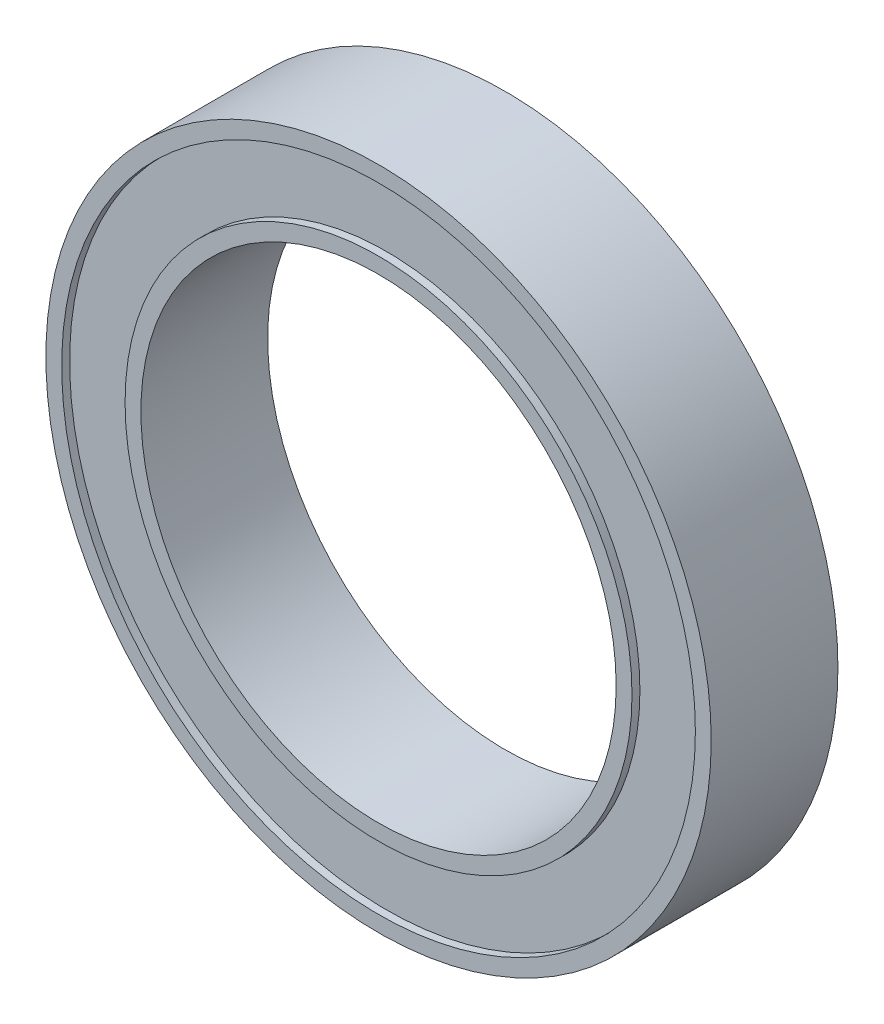
from build123d import *

# Parameters (mm, degrees)
SKETCH2_R             = 10.5
SKETCH2_R_2           = 10
BOSS_EXTRUDE2_DEPTH   = 4
SKETCH2_R_3           = 8
SKETCH2_R_4           = 7.5
BOSS_EXTRUDE2_2_DEPTH = 4
BOSS_EXTRUDE3_START   = 0.25
SKETCH1_R             = 10.5
SKETCH1_R_2           = 7.5
BOSS_EXTRUDE3_DEPTH   = 3.5


with BuildPart() as part:
    # Sketch2 → Boss-Extrude2 (new body)
    with BuildSketch(Plane.XY):
        Circle(SKETCH2_R)
        Circle(SKETCH2_R_2, mode=Mode.SUBTRACT)
    extrude(amount=BOSS_EXTRUDE2_DEPTH)



with BuildPart() as body_2:
    # Sketch2 → Boss-Extrude2 2 (new body)
    with BuildSketch(Plane.XY):
        Circle(SKETCH2_R_3)
        Circle(SKETCH2_R_4, mode=Mode.SUBTRACT)
    extrude(amount=BOSS_EXTRUDE2_2_DEPTH)


with BuildPart() as part_1:
    add(part.part)

    add(body_2.part)  # Boss-Extrude3 merges body 2
    # Sketch1 → Boss-Extrude3 (add)
    with BuildSketch(Plane.XY.offset(BOSS_EXTRUDE3_START)):
        Circle(SKETCH1_R)
        Circle(SKETCH1_R_2, mode=Mode.SUBTRACT)
    extrude(amount=BOSS_EXTRUDE3_DEPTH)


solid = part_1.part
